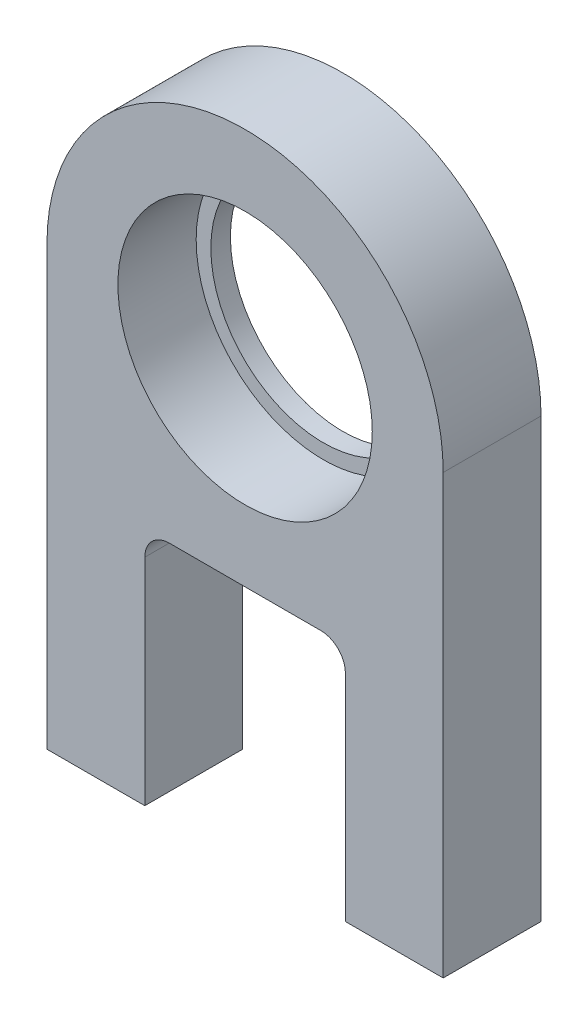
from build123d import *

# Parameters (mm, degrees)
BOSS_EXTRUDE1_DEPTH       = 5
BOSS_EXTRUDE1_DEPTH_BACK  = 5
SKETCH1_R                 = 13
SKETCH2_R                 = 13
SKETCH2_R_2               = 11.5
BOSS_EXTRUDE2_DEPTH       = 2
M5X0_8_TAPPED_HOLE1_D     = 4.2
M5X0_8_TAPPED_HOLE1_DEPTH = 15
M5X0_8_TAPPED_HOLE1_TIP   = 1.2618073
FILLET1_R                 = 2.5


with BuildPart() as part:
    # Sketch1 → Boss-Extrude1 (new, two sides: drawn at the far end of the back side and taken through both)
    with BuildSketch(Plane.XY.offset(-BOSS_EXTRUDE1_DEPTH_BACK)):
        with BuildLine():
            Line((-10.25, -20.25), (10.25, -20.25))
            Line((10.25, -20.25), (10.25, -44.75))
            Line((10.25, -44.75), (20.25, -44.75))
            Line((20.25, -44.75), (20.25, 0))
            ThreePointArc((20.25, 0), (0, 20.25), (-20.25, 0))
            Line((-20.25, 0), (-20.25, -44.75))
            Line((-20.25, -44.75), (-10.25, -44.75))
            Line((-10.25, -44.75), (-10.25, -20.25))
        make_face()
        Circle(SKETCH1_R, mode=Mode.SUBTRACT)
    extrude(amount=BOSS_EXTRUDE1_DEPTH + BOSS_EXTRUDE1_DEPTH_BACK)

    # Sketch2 → Boss-Extrude2 (add)
    with BuildSketch(Plane(origin=(0, 0, -5), x_dir=(-1, 0, 0), z_dir=(0, 0, -1))):
        Circle(SKETCH2_R)
        Circle(SKETCH2_R_2, mode=Mode.SUBTRACT)
    extrude(amount=-BOSS_EXTRUDE2_DEPTH)

    # M5x0.8 Tapped Hole1
    with Locations(Plane(origin=(0, -44.75, 0), x_dir=(-1, 0, 0), z_dir=(0, -1, 0))):
        with Locations((15.75, 0), (-15.75, 0)):
            Hole(M5X0_8_TAPPED_HOLE1_D / 2, depth=M5X0_8_TAPPED_HOLE1_DEPTH)
            with Locations((0, 0, -(M5X0_8_TAPPED_HOLE1_DEPTH + M5X0_8_TAPPED_HOLE1_TIP / 2))):  # 118° drill point
                Cone(0, M5X0_8_TAPPED_HOLE1_D / 2, M5X0_8_TAPPED_HOLE1_TIP, mode=Mode.SUBTRACT)

    # Fillet1
    fillet1_edges = [part.edges().sort_by_distance(p)[0] for p in [
        (10.25, -20.25, 0),
        (-10.25, -20.25, 0),
    ]]
    fillet(fillet1_edges, radius=FILLET1_R)


solid = part.part
